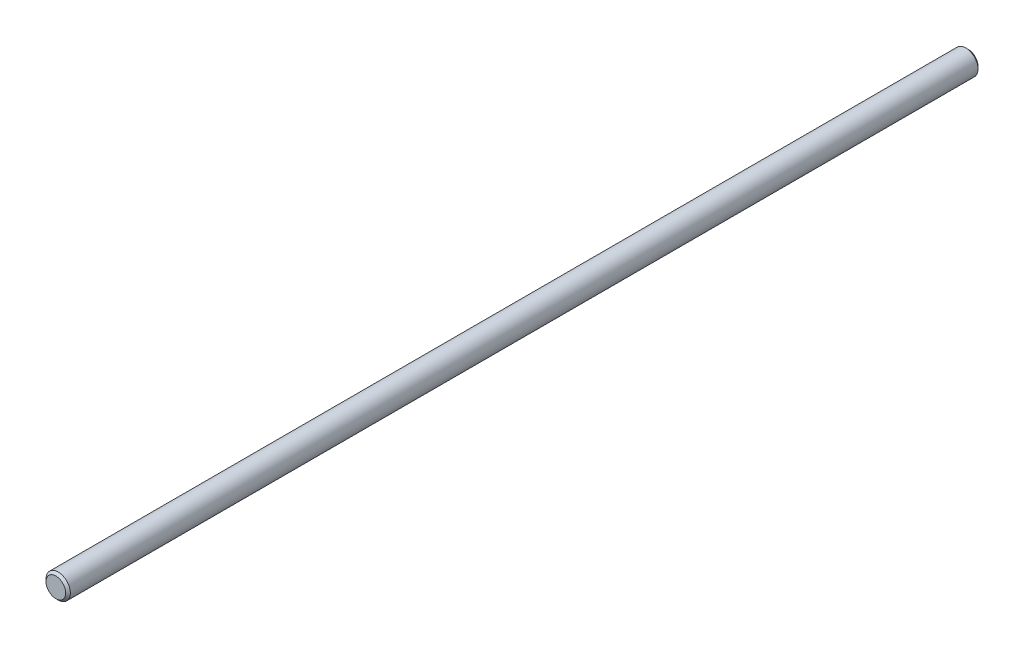
from build123d import *

# Parameters (mm, degrees)
SKETCH1_R           = 2
BOSS_EXTRUDE1_DEPTH = 150
CHAMFER1_SIZE       = 0.381


with BuildPart() as part:
    # Sketch1 → Boss-Extrude1 (new body)
    with BuildSketch(Plane.XY):
        Circle(SKETCH1_R)
    extrude(amount=BOSS_EXTRUDE1_DEPTH)

    # Chamfer1
    chamfer1_edges = [part.edges().sort_by_distance(p)[0] for p in [
        (-2, 0, 0),
        (-2, 0, 150),
    ]]
    chamfer(chamfer1_edges, length=CHAMFER1_SIZE)


solid = part.part
